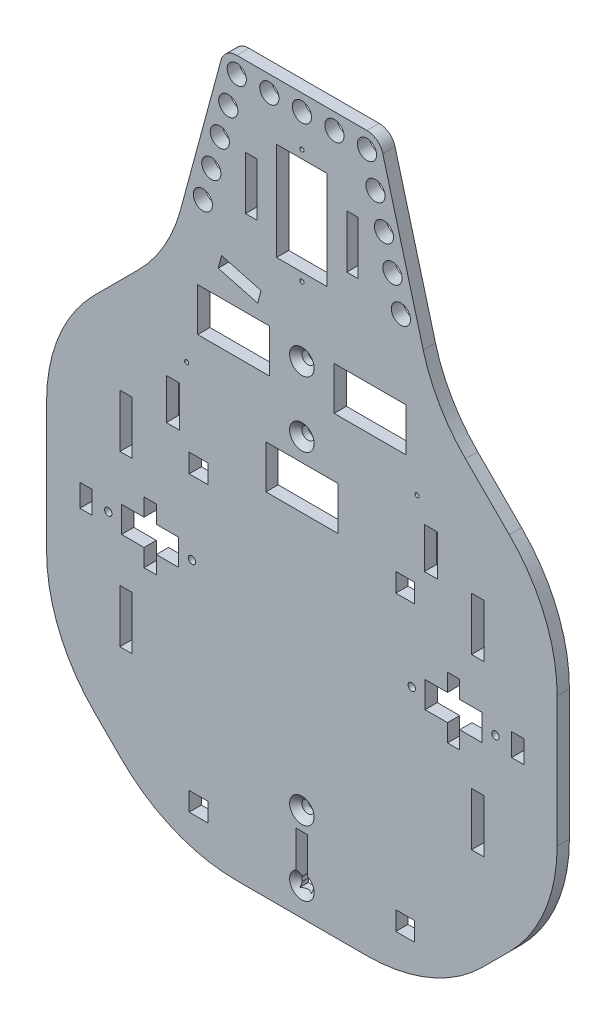
from build123d import *

# Parameters (mm, degrees)
SKICA1_R                 = 0.5
SKICA1_R_2               = 2.35
SKICA1_R_3               = 0.9
SKICA1_W                 = 3
SKICA1_H                 = 13
SKICA1_H_2               = 5.5
SKICA1_W_2               = 17.6
SKICA1_H_3               = 10.6
SKICA1_W_3               = 12.4
SKICA1_H_4               = 24
SKICA1_W_4               = 2.8
SKICA1_W_5               = 3.2
SKICA1_H_5               = 10
SKICA1_W_6               = 4.6
SKICA1_H_6               = 4.6
P_IDAT_VYSUNUT_M1_DEPTH  = 3
SKICA2_R                 = 1.5
ODEBRAT_VYSUNUT_M1_DEPTH = 3
ZKOSEN_1_SIZE            = 1.5
ZAOBLIT1_R               = 40
ZAOBLIT2_R               = 4
SKICA3_R                 = 0.5
SKICA3_W                 = 2.8
SKICA3_H                 = 13
ODEBRAT_VYSUNUT_M2_DEPTH = 129.730338305


with BuildPart() as part:
    # Skica1 → Přidat vysunutím1 (new body)
    with BuildSketch(Plane.XY):
        Polygon((-62.5, -32.5), (-62.5, 32.5), (-32.5, 62.5), (-19.003438856, 112.5), (19.003438856, 112.5), (32.5, 62.5), (62.5, 32.5), (62.5, -32.5), (32.5, -62.5), (-32.5, -62.5), align=None)
        with Locations((0, 100.5)):
            Circle(SKICA1_R, mode=Mode.SUBTRACT)
        with Locations(Location((0, 72.5, 0), (0, 0, 180))):
            Circle(SKICA1_R, mode=Mode.SUBTRACT)
        with Locations((0, 108.5)):
            Circle(SKICA1_R_2, mode=Mode.SUBTRACT)
        with Locations((7.97, 108.5)):
            Circle(SKICA1_R_2, mode=Mode.SUBTRACT)
        with Locations((15.94, 108.5)):
            Circle(SKICA1_R_2, mode=Mode.SUBTRACT)
        with Locations(Location((-15.94, 108.5, 0), (0, 0, 180))):
            Circle(SKICA1_R_2, mode=Mode.SUBTRACT)
        with Locations(Location((-7.97, 108.5, 0), (0, 0, 180))):
            Circle(SKICA1_R_2, mode=Mode.SUBTRACT)
        with Locations(Location((-18.017013584, 100.805397049, 0), (0, 0, 180))):
            Circle(SKICA1_R_2, mode=Mode.SUBTRACT)
        with Locations((-20.094027168, 93.110794098)):
            Circle(SKICA1_R_2, mode=Mode.SUBTRACT)
        with Locations((-22.171040752, 85.416191147)):
            Circle(SKICA1_R_2, mode=Mode.SUBTRACT)
        with Locations((-24.248054336, 77.721588196)):
            Circle(SKICA1_R_2, mode=Mode.SUBTRACT)
        with Locations(Location((24.248054336, 77.721588196, 0), (0, 0, 180))):
            Circle(SKICA1_R_2, mode=Mode.SUBTRACT)
        with Locations(Location((22.171040752, 85.416191147, 0), (0, 0, 180))):
            Circle(SKICA1_R_2, mode=Mode.SUBTRACT)
        with Locations(Location((20.094027168, 93.110794098, 0), (0, 0, 180))):
            Circle(SKICA1_R_2, mode=Mode.SUBTRACT)
        with Locations((18.017013584, 100.805397049)):
            Circle(SKICA1_R_2, mode=Mode.SUBTRACT)
        with Locations((47.397781356, 0)):
            Circle(SKICA1_R_3, mode=Mode.SUBTRACT)
        with Locations(Location((26.897781356, 0, 0), (0, 0, 180))):
            Circle(SKICA1_R_3, mode=Mode.SUBTRACT)
        with Locations(Location((-47.397781356, 0, 0), (0, 0, 180))):
            Circle(SKICA1_R_3, mode=Mode.SUBTRACT)
        with Locations((-26.897781356, 0)):
            Circle(SKICA1_R_3, mode=Mode.SUBTRACT)
        Polygon((-44.147781356, 3.2), (-38.647781356, 3.2), (-38.647781356, 7.5), (-35.647781356, 7.5), (-35.647781356, 3.2), (-30.147781356, 3.2), (-30.147781356, -3.2), (-35.647781356, -3.2), (-35.647781356, -7.5), (-38.647781356, -7.5), (-38.647781356, -3.2), (-44.147781356, -3.2), align=None, mode=Mode.SUBTRACT)
        with Locations((-43.047781356, 20.7)):
            Rectangle(SKICA1_W, SKICA1_H, mode=Mode.SUBTRACT)
        with Locations((-52.847781356, 0)):
            Rectangle(SKICA1_W, SKICA1_H_2, mode=Mode.SUBTRACT)
        with Locations((-43.047781356, -20.7)):
            Rectangle(SKICA1_W, SKICA1_H, mode=Mode.SUBTRACT)
        Polygon((38.647781356, -7.5), (35.647781356, -7.5), (35.647781356, -3.2), (30.147781356, -3.2), (30.147781356, 3.2), (35.647781356, 3.2), (35.647781356, 7.5), (38.647781356, 7.5), (38.647781356, 3.2), (44.147781356, 3.2), (44.147781356, -3.2), (38.647781356, -3.2), align=None, mode=Mode.SUBTRACT)
        with Locations((52.847781356, 0)):
            Rectangle(SKICA1_W, SKICA1_H_2, mode=Mode.SUBTRACT)
        with Locations((43.047781356, 20.7)):
            Rectangle(SKICA1_W, SKICA1_H, mode=Mode.SUBTRACT)
        with Locations((43.047781356, -20.7)):
            Rectangle(SKICA1_W, SKICA1_H, mode=Mode.SUBTRACT)
        with Locations((16.7, 53.8)):
            Rectangle(SKICA1_W_2, SKICA1_H_3, mode=Mode.SUBTRACT)
        with Locations((0, 28.8)):
            Rectangle(SKICA1_W_2, SKICA1_H_3, mode=Mode.SUBTRACT)
        with Locations((-16.7, 53.8)):
            Rectangle(SKICA1_W_2, SKICA1_H_3, mode=Mode.SUBTRACT)
        with Locations((0, 86.5)):
            Rectangle(SKICA1_W_3, SKICA1_H_4, mode=Mode.SUBTRACT)
        with Locations((-12.4, 86.5)):
            Rectangle(SKICA1_W_4, SKICA1_H, mode=Mode.SUBTRACT)
        Polygon((-20.487479207, 65.088190451), (-10.828220944, 62.5), (-10, 65.590962644), (-19.659258263, 68.179153095), align=None, mode=Mode.SUBTRACT)
        with Locations((12.4, 86.5)):
            Rectangle(SKICA1_W_4, SKICA1_H, mode=Mode.SUBTRACT)
        with Locations((31.6, 31)):
            Rectangle(SKICA1_W_5, SKICA1_H_5, mode=Mode.SUBTRACT)
        with Locations((-31.6, 31)):
            Rectangle(SKICA1_W_5, SKICA1_H_5, mode=Mode.SUBTRACT)
        with Locations((25.3, 20.23)):
            Rectangle(SKICA1_W_6, SKICA1_H_6, mode=Mode.SUBTRACT)
        with Locations((25.3, -51.5)):
            Rectangle(SKICA1_W_6, SKICA1_H_6, mode=Mode.SUBTRACT)
        with Locations((-25.3, -51.5)):
            Rectangle(SKICA1_W_6, SKICA1_H_6, mode=Mode.SUBTRACT)
        with Locations((-25.3, 20.23)):
            Rectangle(SKICA1_W_6, SKICA1_H_6, mode=Mode.SUBTRACT)
    extrude(amount=P_IDAT_VYSUNUT_M1_DEPTH)

    # Skica2 → Odebrat vysunutím1 (cut)
    with BuildSketch(Plane.XY):
        with Locations(Location((0, 39.6, 0), (0, 0, 180))):
            Circle(SKICA2_R)
        with Locations(Location((0, 55.6, 0), (0, 0, 180))):
            Circle(SKICA2_R)
        with Locations(Location((0, -55.6, 0), (0, 0, 180))):
            Circle(SKICA2_R)
        with Locations(Location((0, -39.6, 0), (0, 0, 180))):
            Circle(SKICA2_R)
    extrude(amount=ODEBRAT_VYSUNUT_M1_DEPTH, mode=Mode.SUBTRACT)

    # Zkosení1
    zkosen_1_edges = [part.edges().sort_by_distance(p)[0] for p in [
        (1.5, 55.6, 3),
        (1.5, -55.6, 3),
        (1.5, -39.6, 3),
        (1.5, 39.6, 3),
    ]]
    chamfer(zkosen_1_edges, length=ZKOSEN_1_SIZE)

    # Zaoblit1
    zaoblit1_edges = [part.edges().sort_by_distance(p)[0] for p in [
        (-62.5, -32.5, 1.5),
        (-62.5, 32.5, 1.5),
        (-32.5, 62.5, 1.5),
        (32.5, 62.5, 1.5),
        (62.5, 32.5, 1.5),
        (62.5, -32.5, 1.5),
        (32.5, -62.5, 1.5),
        (-32.5, -62.5, 1.5),
    ]]
    fillet(zaoblit1_edges, radius=ZAOBLIT1_R)

    # Zaoblit2
    zaoblit2_edges = [part.edges().sort_by_distance(p)[0] for p in [
        (-19.003438856, 112.5, 1.5),
        (19.003438856, 112.5, 1.5),
    ]]
    fillet(zaoblit2_edges, radius=ZAOBLIT2_R)

    # Skica3 → Odebrat vysunutím2 (cut, through all)
    with BuildSketch(Plane.XY.offset(3)):
        with Locations((-28.2, 41.3)):
            Circle(SKICA3_R)
        with Locations(Location((28.2, 41.3, 0), (0, 0, 180))):
            Circle(SKICA3_R)
        with Locations((0, -50.6)):
            Rectangle(SKICA3_W, SKICA3_H)
    extrude(amount=-ODEBRAT_VYSUNUT_M2_DEPTH, mode=Mode.SUBTRACT)


solid = part.part
